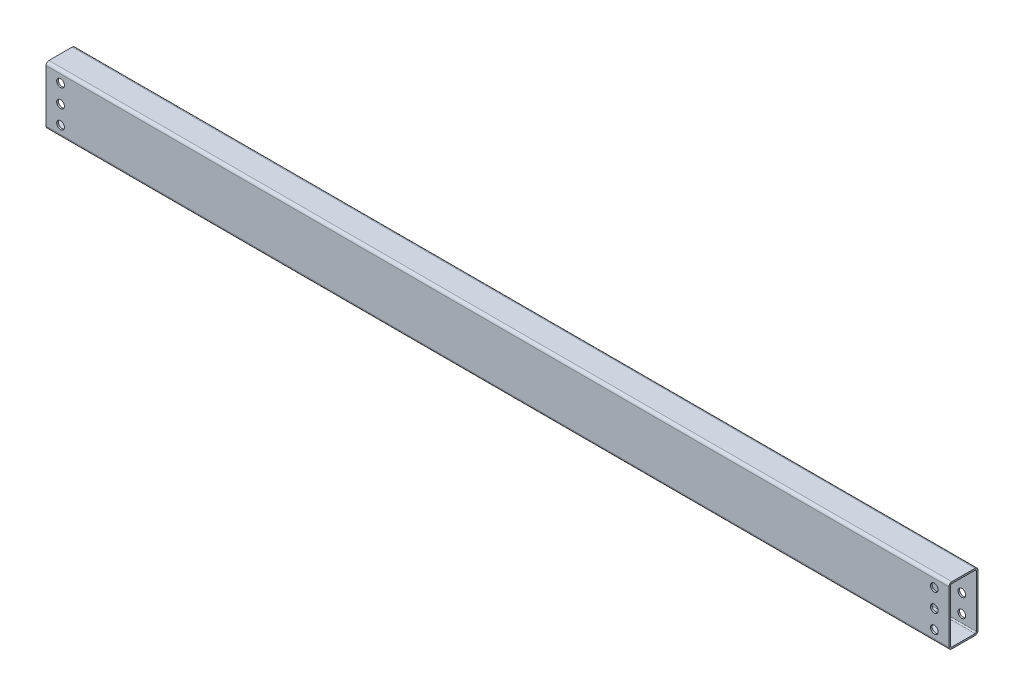
from build123d import *

# Parameters (mm, degrees)
EXTRUDE_THIN1_DEPTH         = 393.7
F_1_4_CLEARANCE_HOLE1_D     = 6.7564
F_1_4_CLEARANCE_HOLE2_D     = 6.7564
F_1_4_CLEARANCE_HOLE2_DEPTH = 1.4478
CUT_EXTRUDE1_DEPTH          = 9.525


with BuildPart() as part:
    # Sketch1 → Extrude-Thin1 (new, symmetric)
    with BuildSketch(Plane(origin=(0, 0, 0), x_dir=(0, 0, -1), z_dir=(1, 0, 0))):
        with BuildLine():
            Line((-10.16, 25.4), (10.16, 25.4))
            ThreePointArc((10.16, 25.4), (11.956051224, 24.656051224), (12.7, 22.86))
            Line((12.7, 22.86), (12.7, -22.86))
            ThreePointArc((12.7, -22.86), (11.956051224, -24.656051224), (10.16, -25.4))
            Line((10.16, -25.4), (-10.16, -25.4))
            ThreePointArc((-10.16, -25.4), (-11.956051224, -24.656051224), (-12.7, -22.86))
            Line((-12.7, -22.86), (-12.7, 22.86))
            ThreePointArc((-12.7, 22.86), (-11.956051224, 24.656051224), (-10.16, 25.4))
        make_face()
        with BuildLine():
            Line((-10.16, 23.9522), (10.16, 23.9522))
            ThreePointArc((10.16, 23.9522), (10.932302026, 23.632302026), (11.2522, 22.86))
            Line((11.2522, 22.86), (11.2522, -22.86))
            ThreePointArc((11.2522, -22.86), (10.932302026, -23.632302026), (10.16, -23.9522))
            Line((10.16, -23.9522), (-10.16, -23.9522))
            ThreePointArc((-10.16, -23.9522), (-10.932302026, -23.632302026), (-11.2522, -22.86))
            Line((-11.2522, -22.86), (-11.2522, 22.86))
            ThreePointArc((-11.2522, 22.86), (-10.932302026, 23.632302026), (-10.16, 23.9522))
        make_face(mode=Mode.SUBTRACT)
    extrude(amount=EXTRUDE_THIN1_DEPTH, both=True)

    # 1/4 Clearance Hole1 (through all)
    with Locations(Plane(origin=(0, 0, -12.7), x_dir=(-1, 0, 0), z_dir=(0, 0, -1))):
        with Locations((-381, 15.875), (-381, -15.875), (-381, 0), (381, -15.875), (381, 0), (381, 15.875)):
            Hole(F_1_4_CLEARANCE_HOLE1_D / 2)

    # 1/4 Clearance Hole2
    with Locations(Plane(origin=(0, 0, -12.7), x_dir=(-1, 0, 0), z_dir=(0, 0, -1))):
        with Locations((-234.95, 15.875), (-234.95, 0), (-234.95, -15.875), (234.95, -15.875), (234.95, 0), (234.95, 15.875)):
            Hole(F_1_4_CLEARANCE_HOLE2_D / 2, depth=F_1_4_CLEARANCE_HOLE2_DEPTH)

    # Sketch6 → Cut-Extrude1 (cut)
    with BuildSketch(Plane(origin=(0, 0, -12.7), x_dir=(-1, 0, 0), z_dir=(0, 0, -1))):
        with BuildLine():
            Line((-120.65, -25.4), (-107.95, -25.4))
            Line((-107.95, -25.4), (-107.95, 15.875))
            ThreePointArc((-107.95, 15.875), (-108.87993597, 18.12006403), (-111.125, 19.05))
            Line((-111.125, 19.05), (-117.475, 19.05))
            ThreePointArc((-117.475, 19.05), (-119.72006403, 18.12006403), (-120.65, 15.875))
            Line((-120.65, 15.875), (-120.65, -25.4))
        make_face()
        with BuildLine():
            Line((-44.45, -25.4), (-31.75, -25.4))
            Line((-31.75, -25.4), (-31.75, 15.875))
            ThreePointArc((-31.75, 15.875), (-32.67993597, 18.12006403), (-34.925, 19.05))
            Line((-34.925, 19.05), (-41.275, 19.05))
            ThreePointArc((-41.275, 19.05), (-43.52006403, 18.12006403), (-44.45, 15.875))
            Line((-44.45, 15.875), (-44.45, -25.4))
        make_face()
        with BuildLine():
            Line((31.75, -25.4), (44.45, -25.4))
            Line((44.45, -25.4), (44.45, 15.875))
            ThreePointArc((44.45, 15.875), (43.52006403, 18.12006403), (41.275, 19.05))
            Line((41.275, 19.05), (34.925, 19.05))
            ThreePointArc((34.925, 19.05), (32.67993597, 18.12006403), (31.75, 15.875))
            Line((31.75, 15.875), (31.75, -25.4))
        make_face()
        with BuildLine():
            Line((107.95, -25.4), (120.65, -25.4))
            Line((120.65, -25.4), (120.65, 15.875))
            ThreePointArc((120.65, 15.875), (119.72006403, 18.12006403), (117.475, 19.05))
            Line((117.475, 19.05), (111.125, 19.05))
            ThreePointArc((111.125, 19.05), (108.87993597, 18.12006403), (107.95, 15.875))
            Line((107.95, 15.875), (107.95, -25.4))
        make_face()
    extrude(amount=-CUT_EXTRUDE1_DEPTH, mode=Mode.SUBTRACT)


solid = part.part
